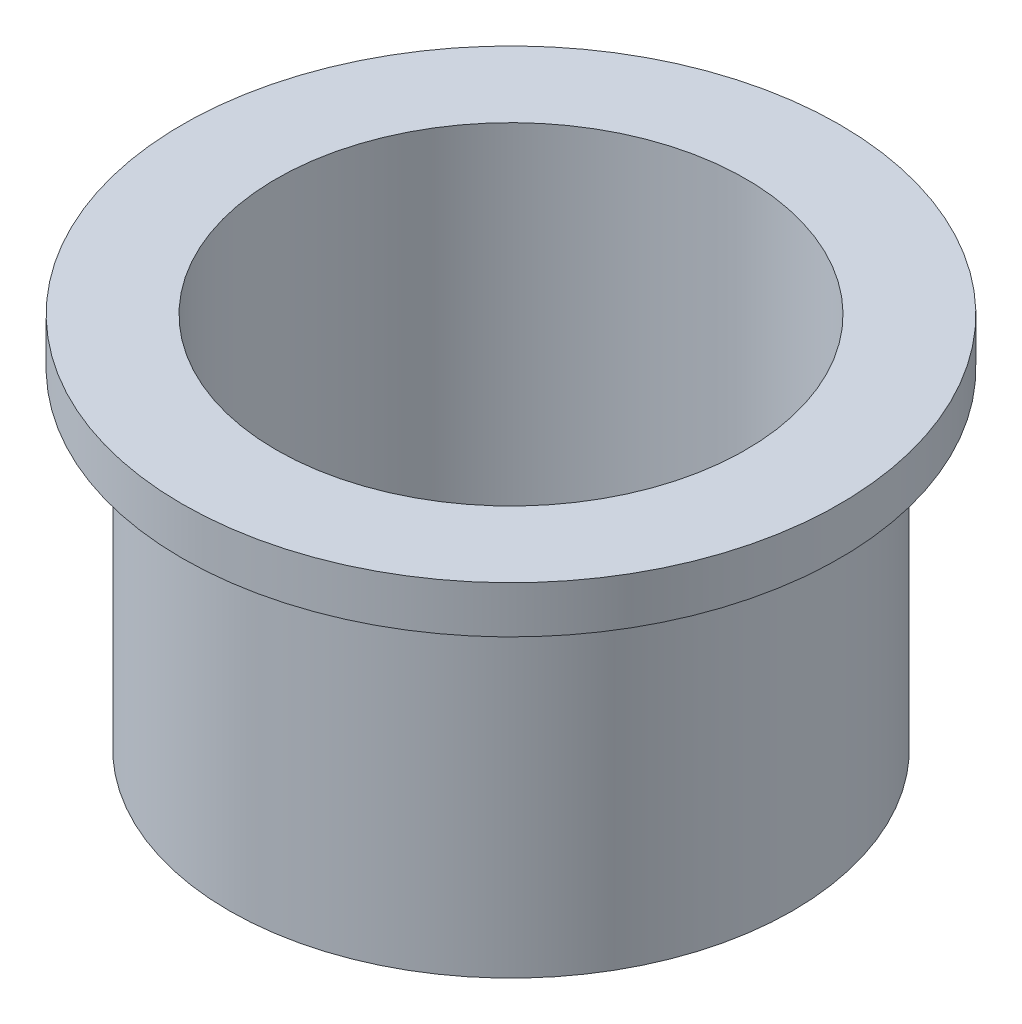
from build123d import *

# Parameters (mm, degrees)
SKETCH1_R           = 15
SKETCH1_R_2         = 12.5
BOSS_EXTRUDE1_DEPTH = 20
BOSS_EXTRUDE2_START = -2.5
SKETCH2_R           = 17.5
SKETCH2_R_2         = 15
BOSS_EXTRUDE2_DEPTH = 2.5


with BuildPart() as part:
    # Sketch1 → Boss-Extrude1 (new body)
    with BuildSketch(Plane(origin=(0, 0, 0), x_dir=(1, 0, 0), z_dir=(0, 1, 0))):
        with Locations(Location((0, 0, 0), (0, 0, 270))):
            Circle(SKETCH1_R)
        with Locations(Location((0, 0, 0), (0, 0, 270))):
            Circle(SKETCH1_R_2, mode=Mode.SUBTRACT)
    extrude(amount=BOSS_EXTRUDE1_DEPTH)

    # Sketch2 → Boss-Extrude2 (add)
    with BuildSketch(Plane(origin=(0, 20, 0), x_dir=(1, 0, 0), z_dir=(0, 1, 0)).offset(BOSS_EXTRUDE2_START)):
        with Locations(Location((0, 0, 0), (0, 0, 270))):
            Circle(SKETCH2_R)
        with Locations(Location((0, 0, 0), (0, 0, 270))):
            Circle(SKETCH2_R_2, mode=Mode.SUBTRACT)
    extrude(amount=BOSS_EXTRUDE2_DEPTH)


solid = part.part
